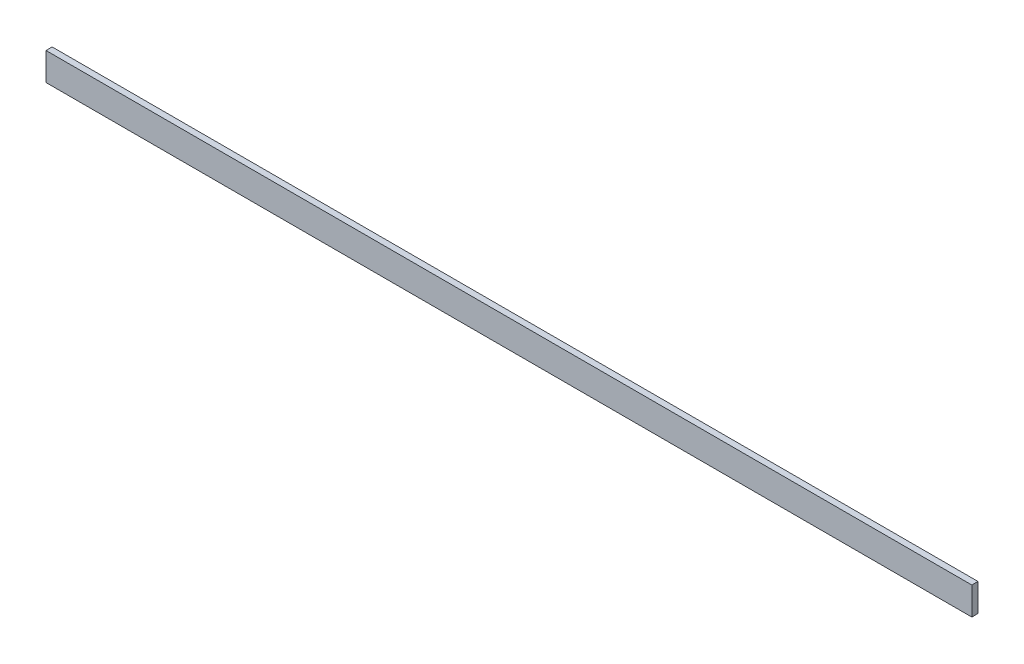
from build123d import *

# Parameters (mm, degrees)
ESQUISSE1_W        = 3000
ESQUISSE1_H        = 90
BOSS_EXTRU_1_DEPTH = 20


with BuildPart() as part:
    # Esquisse1 → Boss.-Extru.1 (new body)
    with BuildSketch(Plane.XY):
        with Locations((1376.378879379, -10.20015202)):
            Rectangle(ESQUISSE1_W, ESQUISSE1_H)
    extrude(amount=BOSS_EXTRU_1_DEPTH)


solid = part.part
